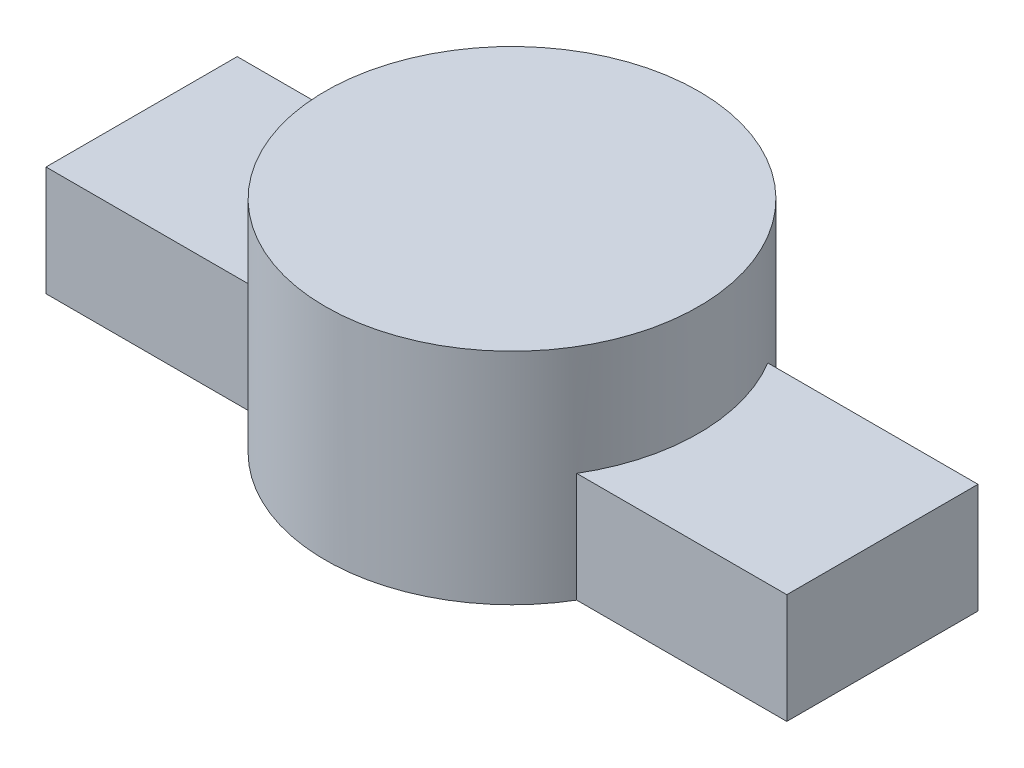
from build123d import *

# Parameters (mm, degrees)
SKETCH1_R           = 8.5
BOSS_EXTRUDE1_DEPTH = 10
SKETCH3_W           = 33.738328928
SKETCH3_H           = 8.707977782
BOSS_EXTRUDE2_DEPTH = 5


with BuildPart() as part:
    # Sketch1 → Boss-Extrude1 (new body)
    with BuildSketch(Plane(origin=(0, 0, 0), x_dir=(1, 0, 0), z_dir=(0, 1, 0))):
        with Locations(Location((0, 0, 0), (0, 0, 270))):
            Circle(SKETCH1_R)
    extrude(amount=BOSS_EXTRUDE1_DEPTH)

    # Sketch3 → Boss-Extrude2 (add)
    with BuildSketch(Plane.XZ):
        Rectangle(SKETCH3_W, SKETCH3_H)
    extrude(amount=-BOSS_EXTRUDE2_DEPTH)


solid = part.part
